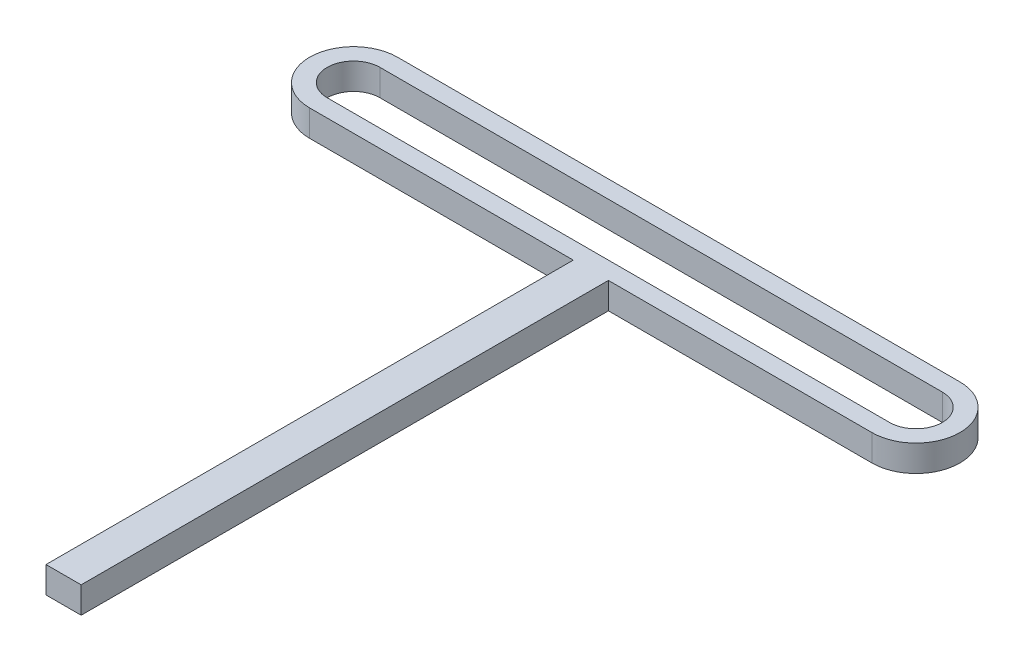
from build123d import *

# Parameters (mm, degrees)
SKETCH2_W           = 4
SKETCH2_H           = 60
BOSS_EXTRUDE1_DEPTH = 3


with BuildPart() as part:
    # Sketch2 → Boss-Extrude1 (new body)
    # profile 1 of 2: a face of its own
    with BuildSketch(Plane(origin=(0, 0, 0), x_dir=(1, 0, 0), z_dir=(0, 1, 0))):
        with BuildLine():
            Line((-32, 5), (32, 5))
            ThreePointArc((32, 5), (37, 0), (32, -5))
            Line((32, -5), (-32, -5))
            ThreePointArc((-32, -5), (-37, 0), (-32, 5))
        make_face()
        with BuildLine():
            ThreePointArc((32, -3), (35, 0), (32, 3))
            Line((32, 3), (-32, 3))
            ThreePointArc((-32, 3), (-35, 0), (-32, -3))
            Line((-32, -3), (32, -3))
        make_face(mode=Mode.SUBTRACT)
    # profile 2 of 2: a face of its own
    with BuildSketch(Plane(origin=(0, 0, 0), x_dir=(1, 0, 0), z_dir=(0, 1, 0))):
        with Locations((0, -35)):
            Rectangle(SKETCH2_W, SKETCH2_H)
    extrude(amount=BOSS_EXTRUDE1_DEPTH)


solid = part.part
